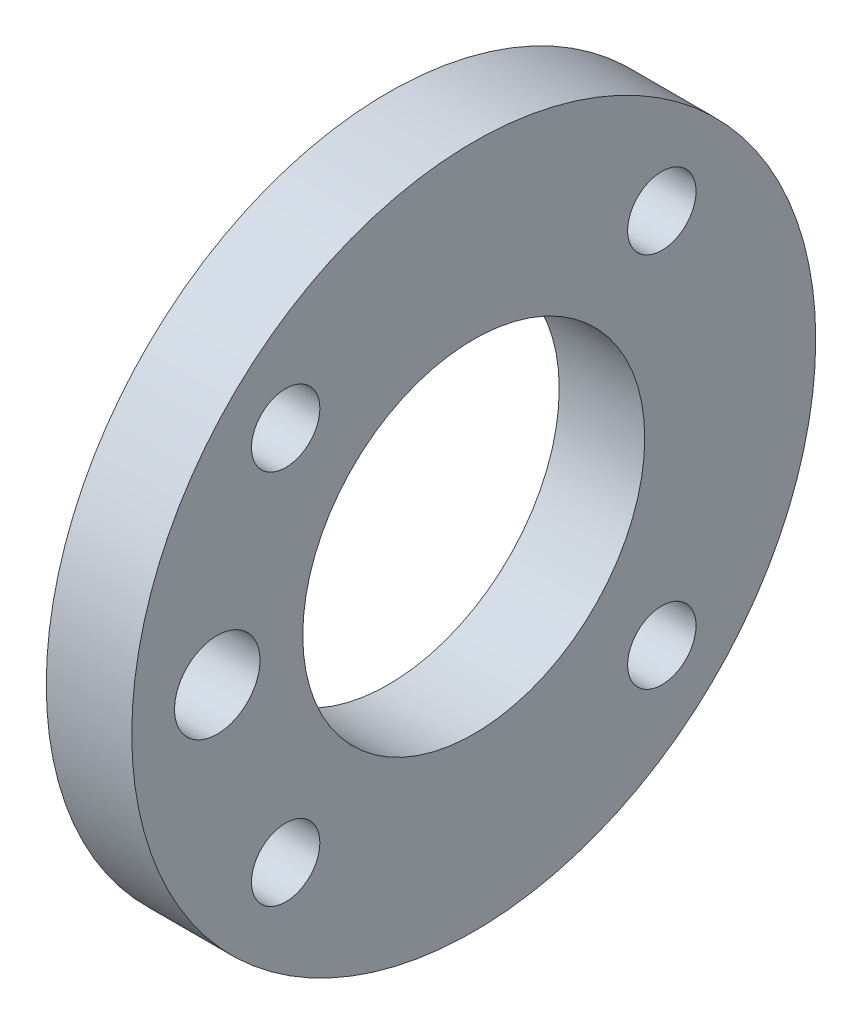
from build123d import *

# Parameters (mm, degrees)
SKETCH1_R           = 20
SKETCH1_R_2         = 10
SKETCH1_R_3         = 2
SKETCH1_R_4         = 2.5
BOSS_EXTRUDE1_DEPTH = 5


with BuildPart() as part:
    # Sketch1 → Boss-Extrude1 (new body)
    with BuildSketch(Plane(origin=(0, 0, 0), x_dir=(0, 0, -1), z_dir=(1, 0, 0))):
        Circle(SKETCH1_R)
        Circle(SKETCH1_R_2, mode=Mode.SUBTRACT)
        with Locations((-11, 11)):
            Circle(SKETCH1_R_3, mode=Mode.SUBTRACT)
        with Locations((11, 11)):
            Circle(SKETCH1_R_3, mode=Mode.SUBTRACT)
        with Locations((11, -11)):
            Circle(SKETCH1_R_3, mode=Mode.SUBTRACT)
        with Locations((-11, -11)):
            Circle(SKETCH1_R_3, mode=Mode.SUBTRACT)
        with Locations((-15, 0)):
            Circle(SKETCH1_R_4, mode=Mode.SUBTRACT)
    extrude(amount=BOSS_EXTRUDE1_DEPTH)


solid = part.part
